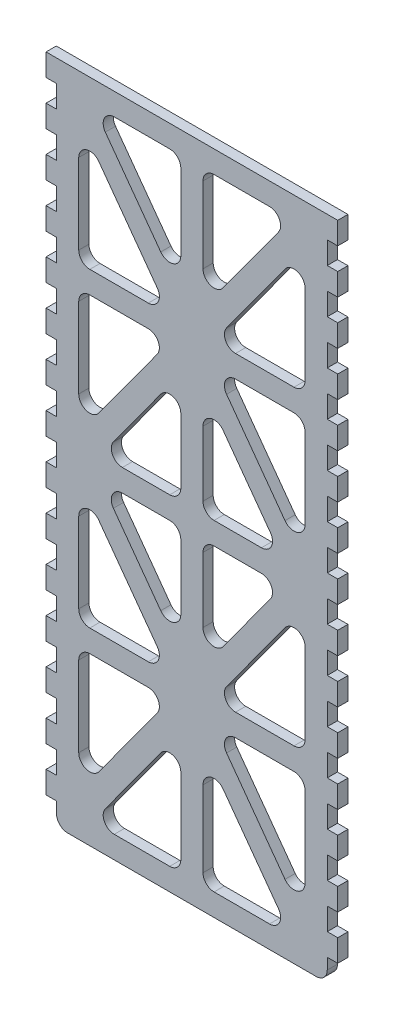
from build123d import *

# Parameters (mm, degrees)
SKETCH1_W                = 77.47
SKETCH1_H                = 190.5
BOSS_EXTRUDE1_DEPTH      = 1.4605
SKETCH2_W                = 2.921
SKETCH2_H                = 6.35
BOSS_EXTRUDE2_DEPTH      = 3
LPATTERN1_COUNT          = 15
LPATTERN1_PITCH          = 12.7
MIRROR1_COPY_1_SKETCH_W  = 2.921
MIRROR1_COPY_1_SKETCH_H  = 6.35
MIRROR1_COPY_1_DEPTH     = 3
MIRROR1_COPY_2_SKETCH_W  = 2.921
MIRROR1_COPY_2_SKETCH_H  = 6.35
MIRROR1_COPY_2_DEPTH     = 3
MIRROR1_COPY_3_SKETCH_W  = 2.921
MIRROR1_COPY_3_SKETCH_H  = 6.35
MIRROR1_COPY_3_DEPTH     = 3
MIRROR1_COPY_4_SKETCH_W  = 2.921
MIRROR1_COPY_4_SKETCH_H  = 6.35
MIRROR1_COPY_4_DEPTH     = 3
MIRROR1_COPY_5_SKETCH_W  = 2.921
MIRROR1_COPY_5_SKETCH_H  = 6.35
MIRROR1_COPY_5_DEPTH     = 3
MIRROR1_COPY_6_SKETCH_W  = 2.921
MIRROR1_COPY_6_SKETCH_H  = 6.35
MIRROR1_COPY_6_DEPTH     = 3
MIRROR1_COPY_7_SKETCH_W  = 2.921
MIRROR1_COPY_7_SKETCH_H  = 6.35
MIRROR1_COPY_7_DEPTH     = 3
MIRROR1_COPY_8_SKETCH_W  = 2.921
MIRROR1_COPY_8_SKETCH_H  = 6.35
MIRROR1_COPY_8_DEPTH     = 3
MIRROR1_COPY_9_SKETCH_W  = 2.921
MIRROR1_COPY_9_SKETCH_H  = 6.35
MIRROR1_COPY_9_DEPTH     = 3
MIRROR1_COPY_10_SKETCH_W = 2.921
MIRROR1_COPY_10_SKETCH_H = 6.35
MIRROR1_COPY_10_DEPTH    = 3
MIRROR1_COPY_11_SKETCH_W = 2.921
MIRROR1_COPY_11_SKETCH_H = 6.35
MIRROR1_COPY_11_DEPTH    = 3
MIRROR1_COPY_12_SKETCH_W = 2.921
MIRROR1_COPY_12_SKETCH_H = 6.35
MIRROR1_COPY_12_DEPTH    = 3
MIRROR1_COPY_13_SKETCH_W = 2.921
MIRROR1_COPY_13_SKETCH_H = 6.35
MIRROR1_COPY_13_DEPTH    = 3
MIRROR1_COPY_14_SKETCH_W = 2.921
MIRROR1_COPY_14_SKETCH_H = 6.35
MIRROR1_COPY_14_DEPTH    = 3
CUT_EXTRUDE1_DEPTH       = 105.033191655
FILLET1_R                = 3.175


with BuildPart() as part:
    # Sketch1 → Boss-Extrude1 (new, symmetric)
    with BuildSketch(Plane.XY):
        Rectangle(SKETCH1_W, SKETCH1_H)
    extrude(amount=BOSS_EXTRUDE1_DEPTH, both=True)

    # Sketch2 → Boss-Extrude2 (add)
    with BuildSketch(Plane(origin=(38.735, 0, 0), x_dir=(0, 0, -1), z_dir=(1, 0, 0))):
        with Locations((0, -85.725)):
            Rectangle(SKETCH2_W, SKETCH2_H)
    boss_extrude2 = extrude(amount=BOSS_EXTRUDE2_DEPTH)

    # LPattern1: Boss-Extrude2 ×15
    with Locations(*[(0, i * LPATTERN1_PITCH, 0) for i in range(1, LPATTERN1_COUNT)]):
        add(boss_extrude2)

    # Mirror1: Boss-Extrude2 across plane
    add(boss_extrude2.mirror(Plane.ZY))

    # Mirror1 copy 1 sketch → Mirror1 copy 1 (add)
    with BuildSketch(Plane(origin=(-38.735, 12.7, 0), x_dir=(0, 0, -1), z_dir=(-1, 0, 0))):
        with Locations((0, 85.725)):
            Rectangle(MIRROR1_COPY_1_SKETCH_W, MIRROR1_COPY_1_SKETCH_H)
    extrude(amount=MIRROR1_COPY_1_DEPTH)

    # Mirror1 copy 2 sketch → Mirror1 copy 2 (add)
    with BuildSketch(Plane(origin=(-38.735, 25.4, 0), x_dir=(0, 0, -1), z_dir=(-1, 0, 0))):
        with Locations((0, 85.725)):
            Rectangle(MIRROR1_COPY_2_SKETCH_W, MIRROR1_COPY_2_SKETCH_H)
    extrude(amount=MIRROR1_COPY_2_DEPTH)

    # Mirror1 copy 3 sketch → Mirror1 copy 3 (add)
    with BuildSketch(Plane(origin=(-38.735, 38.1, 0), x_dir=(0, 0, -1), z_dir=(-1, 0, 0))):
        with Locations((0, 85.725)):
            Rectangle(MIRROR1_COPY_3_SKETCH_W, MIRROR1_COPY_3_SKETCH_H)
    extrude(amount=MIRROR1_COPY_3_DEPTH)

    # Mirror1 copy 4 sketch → Mirror1 copy 4 (add)
    with BuildSketch(Plane(origin=(-38.735, 50.8, 0), x_dir=(0, 0, -1), z_dir=(-1, 0, 0))):
        with Locations((0, 85.725)):
            Rectangle(MIRROR1_COPY_4_SKETCH_W, MIRROR1_COPY_4_SKETCH_H)
    extrude(amount=MIRROR1_COPY_4_DEPTH)

    # Mirror1 copy 5 sketch → Mirror1 copy 5 (add)
    with BuildSketch(Plane(origin=(-38.735, 63.5, 0), x_dir=(0, 0, -1), z_dir=(-1, 0, 0))):
        with Locations((0, 85.725)):
            Rectangle(MIRROR1_COPY_5_SKETCH_W, MIRROR1_COPY_5_SKETCH_H)
    extrude(amount=MIRROR1_COPY_5_DEPTH)

    # Mirror1 copy 6 sketch → Mirror1 copy 6 (add)
    with BuildSketch(Plane(origin=(-38.735, 76.2, 0), x_dir=(0, 0, -1), z_dir=(-1, 0, 0))):
        with Locations((0, 85.725)):
            Rectangle(MIRROR1_COPY_6_SKETCH_W, MIRROR1_COPY_6_SKETCH_H)
    extrude(amount=MIRROR1_COPY_6_DEPTH)

    # Mirror1 copy 7 sketch → Mirror1 copy 7 (add)
    with BuildSketch(Plane(origin=(-38.735, 88.9, 0), x_dir=(0, 0, -1), z_dir=(-1, 0, 0))):
        with Locations((0, 85.725)):
            Rectangle(MIRROR1_COPY_7_SKETCH_W, MIRROR1_COPY_7_SKETCH_H)
    extrude(amount=MIRROR1_COPY_7_DEPTH)

    # Mirror1 copy 8 sketch → Mirror1 copy 8 (add)
    with BuildSketch(Plane(origin=(-38.735, 101.6, 0), x_dir=(0, 0, -1), z_dir=(-1, 0, 0))):
        with Locations((0, 85.725)):
            Rectangle(MIRROR1_COPY_8_SKETCH_W, MIRROR1_COPY_8_SKETCH_H)
    extrude(amount=MIRROR1_COPY_8_DEPTH)

    # Mirror1 copy 9 sketch → Mirror1 copy 9 (add)
    with BuildSketch(Plane(origin=(-38.735, 114.3, 0), x_dir=(0, 0, -1), z_dir=(-1, 0, 0))):
        with Locations((0, 85.725)):
            Rectangle(MIRROR1_COPY_9_SKETCH_W, MIRROR1_COPY_9_SKETCH_H)
    extrude(amount=MIRROR1_COPY_9_DEPTH)

    # Mirror1 copy 10 sketch → Mirror1 copy 10 (add)
    with BuildSketch(Plane(origin=(-38.735, 127, 0), x_dir=(0, 0, -1), z_dir=(-1, 0, 0))):
        with Locations((0, 85.725)):
            Rectangle(MIRROR1_COPY_10_SKETCH_W, MIRROR1_COPY_10_SKETCH_H)
    extrude(amount=MIRROR1_COPY_10_DEPTH)

    # Mirror1 copy 11 sketch → Mirror1 copy 11 (add)
    with BuildSketch(Plane(origin=(-38.735, 139.7, 0), x_dir=(0, 0, -1), z_dir=(-1, 0, 0))):
        with Locations((0, 85.725)):
            Rectangle(MIRROR1_COPY_11_SKETCH_W, MIRROR1_COPY_11_SKETCH_H)
    extrude(amount=MIRROR1_COPY_11_DEPTH)

    # Mirror1 copy 12 sketch → Mirror1 copy 12 (add)
    with BuildSketch(Plane(origin=(-38.735, 152.4, 0), x_dir=(0, 0, -1), z_dir=(-1, 0, 0))):
        with Locations((0, 85.725)):
            Rectangle(MIRROR1_COPY_12_SKETCH_W, MIRROR1_COPY_12_SKETCH_H)
    extrude(amount=MIRROR1_COPY_12_DEPTH)

    # Mirror1 copy 13 sketch → Mirror1 copy 13 (add)
    with BuildSketch(Plane(origin=(-38.735, 165.1, 0), x_dir=(0, 0, -1), z_dir=(-1, 0, 0))):
        with Locations((0, 85.725)):
            Rectangle(MIRROR1_COPY_13_SKETCH_W, MIRROR1_COPY_13_SKETCH_H)
    extrude(amount=MIRROR1_COPY_13_DEPTH)

    # Mirror1 copy 14 sketch → Mirror1 copy 14 (add)
    with BuildSketch(Plane(origin=(-38.735, 177.8, 0), x_dir=(0, 0, -1), z_dir=(-1, 0, 0))):
        with Locations((0, 85.725)):
            Rectangle(MIRROR1_COPY_14_SKETCH_W, MIRROR1_COPY_14_SKETCH_H)
    extrude(amount=MIRROR1_COPY_14_DEPTH)

    # Sketch4 → Cut-Extrude1 (cut, through all)
    with BuildSketch(Plane.XY.offset(1.4605)):
        Polygon((-32.385, 83.508207922), (-32.385, 47.625), (-6.241519942, 47.625), align=None)
        Polygon((-28.456694343, 88.9), (-3.175, 54.199635215), (-3.175, 88.9), align=None)
        Polygon((3.175, 88.9), (3.175, 54.199635215), (28.456694343, 88.9), align=None)
        Polygon((32.385, 83.508207922), (6.241519942, 47.625), (32.385, 47.625), align=None)
        Polygon((6.241519942, 41.275), (32.385, 5.391792078), (32.385, 41.275), align=None)
        Polygon((3.175, 34.700364785), (3.175, 3.175), (26.143480058, 3.175), align=None)
        Polygon((-26.143480058, 3.175), (-3.175, 3.175), (-3.175, 34.700364785), align=None)
        Polygon((-32.385, 41.275), (-32.385, 5.391792078), (-6.241519942, 41.275), align=None)
        Polygon((-3.175, -34.700364785), (-3.175, -3.175), (-26.143480058, -3.175), align=None)
        Polygon((26.143480058, -3.175), (3.175, -3.175), (3.175, -34.700364785), align=None)
        Polygon((32.385, -41.275), (32.385, -5.391792078), (6.241519942, -41.275), align=None)
        Polygon((32.385, -47.625), (6.241519942, -47.625), (32.385, -83.508207922), align=None)
        Polygon((28.456694343, -88.9), (3.175, -54.199635215), (3.175, -88.9), align=None)
        Polygon((-3.175, -88.9), (-3.175, -54.199635215), (-28.456694343, -88.9), align=None)
        Polygon((-6.241519942, -47.625), (-32.385, -47.625), (-32.385, -83.508207922), align=None)
        Polygon((-6.241519942, -41.275), (-32.385, -5.391792078), (-32.385, -41.275), align=None)
    extrude(amount=-CUT_EXTRUDE1_DEPTH, mode=Mode.SUBTRACT)

    # Fillet1
    fillet1_edges = [part.edges().sort_by_distance(p)[0] for p in [
        (3.175, 34.700364785, 0),
        (26.143480058, 3.175, 0),
        (3.175, 3.175, 0),
        (-3.175, 34.700364785, 0),
        (-3.175, 3.175, 0),
        (-26.143480058, 3.175, 0),
        (-32.385, 41.275, 0),
        (-6.241519942, 41.275, 0),
        (-32.385, 5.391792078, 0),
        (-26.143480058, -3.175, 0),
        (-3.175, -3.175, 0),
        (-3.175, -34.700364785, 0),
        (-3.175, 88.9, 0),
        (-3.175, 54.199635215, 0),
        (-28.456694343, 88.9, 0),
        (28.456694343, 88.9, 0),
        (3.175, 54.199635215, 0),
        (3.175, 88.9, 0),
        (6.241519942, 47.625, 0),
        (32.385, 83.508207922, 0),
        (32.385, 47.625, 0),
        (6.241519942, 41.275, 0),
        (32.385, 41.275, 0),
        (32.385, 5.391792078, 0),
        (32.385, -41.275, 0),
        (6.241519942, -41.275, 0),
        (32.385, -5.391792078, 0),
        (3.175, -3.175, 0),
        (26.143480058, -3.175, 0),
        (3.175, -34.700364785, 0),
        (3.175, -54.199635215, 0),
        (28.456694343, -88.9, 0),
        (3.175, -88.9, 0),
        (32.385, -47.625, 0),
        (32.385, -83.508207922, 0),
        (6.241519942, -47.625, 0),
        (-6.241519942, -47.625, 0),
        (-32.385, -83.508207922, 0),
        (-32.385, -47.625, 0),
        (-3.175, -54.199635215, 0),
        (-3.175, -88.9, 0),
        (-28.456694343, -88.9, 0),
        (-6.241519942, -41.275, 0),
        (-32.385, -41.275, 0),
        (-32.385, -5.391792078, 0),
        (-32.385, 83.508207922, 0),
        (-6.241519942, 47.625, 0),
        (-32.385, 47.625, 0),
        (38.735, -95.25, 0),
        (-38.735, -95.25, 0),
    ]]
    fillet(fillet1_edges, radius=FILLET1_R)


solid = part.part
